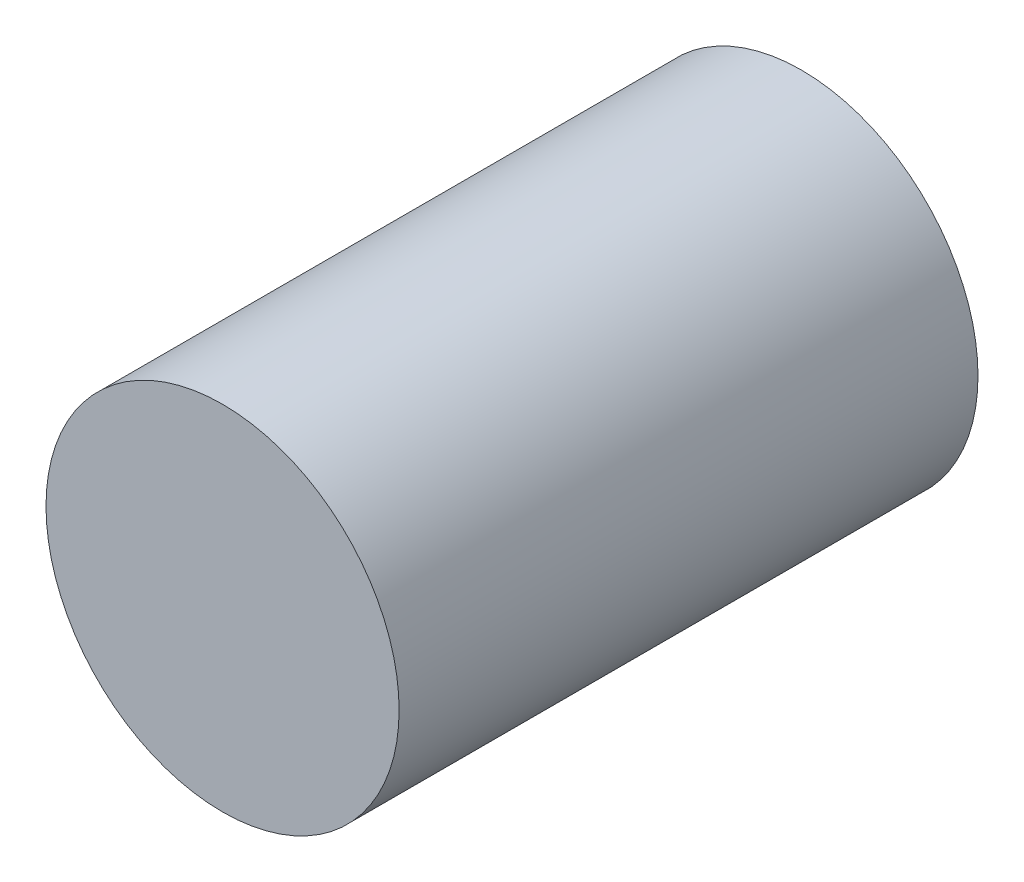
from build123d import *

# Parameters (mm, degrees)
SKETCH1_R           = 61
BOSS_EXTRUDE1_DEPTH = 100


with BuildPart() as part:
    # Sketch1 → Boss-Extrude1 (new, symmetric)
    with BuildSketch(Plane.XY):
        Circle(SKETCH1_R)
    extrude(amount=BOSS_EXTRUDE1_DEPTH, both=True)


solid = part.part
